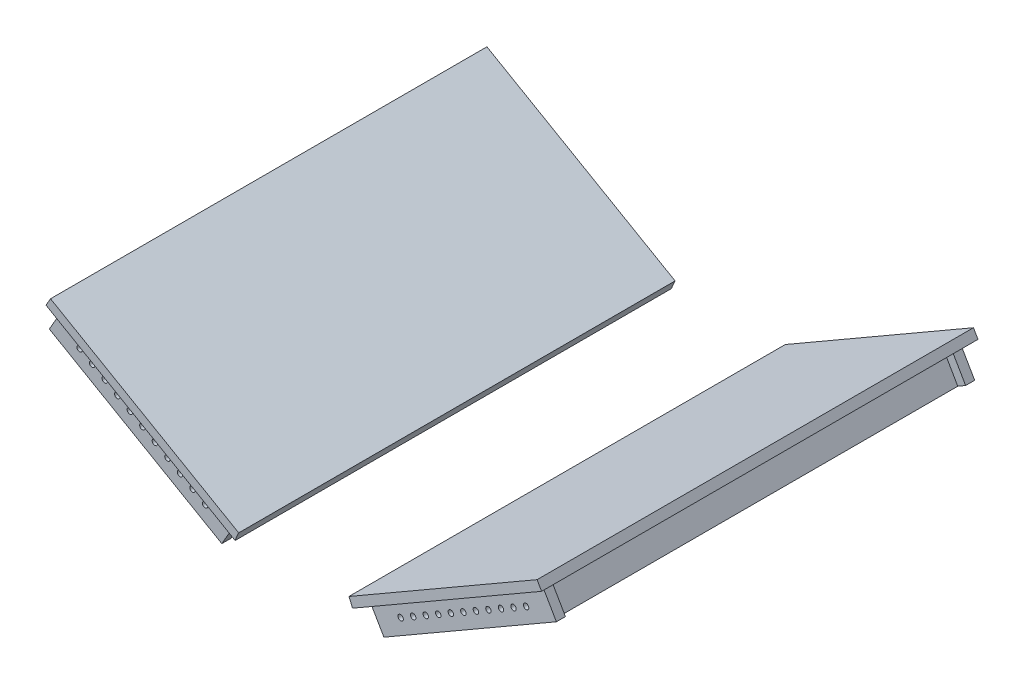
from build123d import *

# Parameters (mm, degrees)
BOSS_EXTRUDE1_DEPTH        = 273.05
BOSS_EXTRUDE1_DEPTH_BACK   = 339.09
BOSS_EXTRUDE1_2_DEPTH      = 273.05
BOSS_EXTRUDE1_2_DEPTH_BACK = 339.09
SKETCH2_W                  = 279.4
SKETCH2_H                  = 12.7
BOSS_EXTRUDE2_DEPTH        = 38.1
BOSS_EXTRUDE2_2_DEPTH      = 38.1
SKETCH3_W                  = 12.7
SKETCH3_H                  = 561.34
BOSS_EXTRUDE3_DEPTH        = 38.1
BOSS_EXTRUDE3_2_DEPTH      = 38.1
SKETCH5_W                  = 12.7
SKETCH5_H                  = 561.34
BOSS_EXTRUDE4_DEPTH        = 38.1
BOSS_EXTRUDE4_2_DEPTH      = 38.1
SKETCH6_R                  = 6.35
CUT_EXTRUDE1_DEPTH         = 12.7
SKETCH7_R                  = 6.35
CUT_EXTRUDE2_DEPTH         = 12.7
UNNECESSARY_DETAIL_DEPTH   = 612.14
CUT_EXTRUDE3_START         = -586.74
SKETCH9_R                  = 3.81
CUT_EXTRUDE3_DEPTH         = 586.74


with BuildPart() as part:
    # Sketch1 → Boss-Extrude1 (new, two sides: drawn at the far end of the back side and taken through both)
    with BuildSketch(Plane(origin=(392.915001613, 557.307056284, 808.85385267), x_dir=(1, 0, 0), z_dir=(0, 0, 1)).offset(-BOSS_EXTRUDE1_DEPTH_BACK)):
        Polygon((77.284288108, 39.663437012), (341.248831182, 192.063437012), (347.598831182, 181.064914384), (83.634288108, 28.664914384), align=None)
    extrude(amount=BOSS_EXTRUDE1_DEPTH + BOSS_EXTRUDE1_DEPTH_BACK)


with BuildPart() as body_2:
    # Sketch1 → Boss-Extrude1 2 (new, two sides: drawn at the far end of the back side and taken through both)
    with BuildSketch(Plane(origin=(392.915001613, 557.307056284, 808.85385267), x_dir=(1, 0, 0), z_dir=(0, 0, 1)).offset(-BOSS_EXTRUDE1_2_DEPTH_BACK)):
        Polygon((-77.284288108, 39.663437012), (-341.248831182, 192.063437012), (-347.598831182, 181.064914384), (-83.634288108, 28.664914384), align=None)
    extrude(amount=BOSS_EXTRUDE1_2_DEPTH + BOSS_EXTRUDE1_2_DEPTH_BACK)


with BuildPart() as body_3:
    # Sketch2 → Boss-Extrude2 (new body)
    with BuildSketch(Plane(origin=(331.053484628, 573.401455399, 0), x_dir=(0.8660254037844372, -0.5000000000000027, 0), z_dir=(-0.5000000000000027, -0.8660254037844372, 0))):
        with Locations((-177.541030539, 1062.85385267)):
            Rectangle(SKETCH2_W, SKETCH2_H)
    boss_extrude2 = extrude(amount=BOSS_EXTRUDE2_DEPTH)


with BuildPart() as body_4:
    # Sketch2 → Boss-Extrude2 2 (new body)
    with BuildSketch(Plane(origin=(331.053484628, 573.401455399, 0), x_dir=(0.8660254037844372, -0.5000000000000027, 0), z_dir=(-0.5000000000000027, -0.8660254037844372, 0))):
        with Locations((-177.541030539, 488.81385267)):
            Rectangle(SKETCH2_W, SKETCH2_H)
    boss_extrude2_2 = extrude(amount=BOSS_EXTRUDE2_2_DEPTH)


with BuildPart() as body_5:
    # Sketch3 → Boss-Extrude3 (new body)
    with BuildSketch(Plane(origin=(331.053484628, 573.401455399, 0), x_dir=(0.8660254037844372, -0.5000000000000027, 0), z_dir=(-0.5000000000000027, -0.8660254037844372, 0))):
        with Locations((-56.891030539, 775.83385267)):
            Rectangle(SKETCH3_W, SKETCH3_H)
    extrude(amount=BOSS_EXTRUDE3_DEPTH)

    # Sketch6 → Cut-Extrude1 (cut)
    with BuildSketch(Plane(origin=(-43.76981638, 25.270515269, 0), x_dir=(0, 0, -1), z_dir=(0.866025403784437, -0.5000000000000028, 0))):
        with Locations(Location((-775.671183514, 643.215670872, 0), (0, 0, 90))):
            Circle(SKETCH6_R)
        with Locations(Location((-621.90985267, 643.056969256, 0), (0, 0, 90))):
            Circle(SKETCH6_R)
        with Locations(Location((-929.75785267, 643.056969256, 0), (0, 0, 90))):
            Circle(SKETCH6_R)
    extrude(amount=-CUT_EXTRUDE1_DEPTH, mode=Mode.SUBTRACT)


with BuildPart() as body_6:
    # Sketch3 → Boss-Extrude3 2 (new body)
    with BuildSketch(Plane(origin=(331.053484628, 573.401455399, 0), x_dir=(0.8660254037844372, -0.5000000000000027, 0), z_dir=(-0.5000000000000027, -0.8660254037844372, 0))):
        with Locations((-298.191030539, 775.83385267)):
            Rectangle(SKETCH3_W, SKETCH3_H)
    extrude(amount=BOSS_EXTRUDE3_2_DEPTH)


with BuildPart() as part_1:
    add(part.part)

    # Mirror1: Boss-Extrude2, Boss-Extrude2 2 across plane
    add(boss_extrude2.mirror(Plane(origin=(392.915001613, 0, 0), x_dir=(0, 0, 1), z_dir=(1, 0, 0))))
    add(boss_extrude2_2.mirror(Plane(origin=(392.915001613, 0, 0), x_dir=(0, 0, 1), z_dir=(1, 0, 0))))

    add(body_2.part)  # Unnecessary Detail merges body 2
    # Sketch8 → Unnecessary Detail (add)
    with BuildSketch(Plane.XY.offset(1081.90385267)):
        with BuildLine():
            Line((310.642299926, 585.186295534), (303.796277895, 589.138411043))
            Line((303.796277895, 589.138411043), (309.256490029, 600.650652935))
            Line((309.256490029, 600.650652935), (315.630713504, 596.970493296))
            ThreePointArc((315.630713504, 596.970493296), (312.919219991, 591.170374885), (310.642299926, 585.186295534))
        make_face()
        with BuildLine():
            Line((475.187703299, 585.186295534), (485.552882068, 591.170197133))
            Line((485.552882068, 591.170197133), (477.229929452, 601.029635038))
            Line((477.229929452, 601.029635038), (470.199289721, 596.970493296))
            ThreePointArc((470.199289721, 596.970493296), (472.910783235, 591.170374885), (475.187703299, 585.186295534))
        make_face()
    extrude(amount=-UNNECESSARY_DETAIL_DEPTH)


with BuildPart() as body_7:
    # Sketch5 → Boss-Extrude4 (new body)
    with BuildSketch(Plane(origin=(-134.595983822, 233.127082474, 0), x_dir=(0.8660254037844386, 0.5000000000000002, 0), z_dir=(0.5000000000000001, -0.8660254037844385, 0))):
        with Locations((737.439776387, 775.83385267)):
            Rectangle(SKETCH5_W, SKETCH5_H)
    extrude(amount=BOSS_EXTRUDE4_DEPTH)

    # Sketch7 → Cut-Extrude2 (cut)
    with BuildSketch(Plane(origin=(633.142318799, 365.544888194, 0), x_dir=(0, 0, 1), z_dir=(-0.8660254037844385, -0.5000000000000003, 0))):
        with Locations(Location((775.83385267, 250.141967644, 0), (0, 0, 270))):
            Circle(SKETCH7_R)
        with Locations(Location((929.75785267, 250.141967644, 0), (0, 0, 270))):
            Circle(SKETCH7_R)
        with Locations(Location((621.90985267, 250.141967644, 0), (0, 0, 270))):
            Circle(SKETCH7_R)
    extrude(amount=-CUT_EXTRUDE2_DEPTH, mode=Mode.SUBTRACT)


with BuildPart() as body_8:
    # Sketch5 → Boss-Extrude4 2 (new body)
    with BuildSketch(Plane(origin=(-134.595983822, 233.127082474, 0), x_dir=(0.8660254037844386, 0.5000000000000002, 0), z_dir=(0.5000000000000001, -0.8660254037844385, 0))):
        with Locations((978.739776387, 775.83385267)):
            Rectangle(SKETCH5_W, SKETCH5_H)
    extrude(amount=BOSS_EXTRUDE4_2_DEPTH)


with BuildPart() as cut_extrude3_tool:
    # Sketch9 → Cut-Extrude3 (new body)
    with BuildSketch(Plane.XY.offset(1069.20385267).offset(CUT_EXTRUDE3_START)):
        with Locations((255.761622992, 594.874186726)):
            Circle(SKETCH9_R)
        with Locations((238.163986787, 605.034186726)):
            Circle(SKETCH9_R)
        with Locations((220.566350582, 615.194186726)):
            Circle(SKETCH9_R)
        with Locations((202.968714377, 625.354186726)):
            Circle(SKETCH9_R)
        with Locations((185.371078173, 635.514186726)):
            Circle(SKETCH9_R)
        with Locations((167.773441968, 645.674186726)):
            Circle(SKETCH9_R)
        with Locations((150.175805763, 655.834186726)):
            Circle(SKETCH9_R)
        with Locations((132.578169558, 665.994186726)):
            Circle(SKETCH9_R)
        with Locations((114.980533353, 676.154186726)):
            Circle(SKETCH9_R)
        with Locations((97.382897148, 686.314186726)):
            Circle(SKETCH9_R)
        with Locations((79.785260943, 696.474186726)):
            Circle(SKETCH9_R)
        with Locations((706.044742282, 696.474186726)):
            Circle(SKETCH9_R)
        with Locations((688.447106077, 686.314186726)):
            Circle(SKETCH9_R)
        with Locations((670.849469872, 676.154186726)):
            Circle(SKETCH9_R)
        with Locations((653.251833667, 665.994186726)):
            Circle(SKETCH9_R)
        with Locations((635.654197462, 655.834186726)):
            Circle(SKETCH9_R)
        with Locations((618.056561257, 645.674186726)):
            Circle(SKETCH9_R)
        with Locations((600.458925052, 635.514186726)):
            Circle(SKETCH9_R)
        with Locations((582.861288848, 625.354186726)):
            Circle(SKETCH9_R)
        with Locations((565.263652643, 615.194186726)):
            Circle(SKETCH9_R)
        with Locations((547.666016438, 605.034186726)):
            Circle(SKETCH9_R)
        with Locations((530.068380233, 594.874186726)):
            Circle(SKETCH9_R)
    cut_extrude3 = extrude(amount=CUT_EXTRUDE3_DEPTH)


with BuildPart() as part_2:
    add(part_1.part)

    # Cut-Extrude3: cut by cut_extrude3_tool
    add(cut_extrude3_tool.part, mode=Mode.SUBTRACT)


with BuildPart() as body_3_1:
    add(body_3.part)

    # Cut-Extrude3: cut by cut_extrude3_tool
    add(cut_extrude3_tool.part, mode=Mode.SUBTRACT)


with BuildPart() as body_4_1:
    add(body_4.part)

    # Mirror2: Cut-Extrude3 across plane
    add(cut_extrude3.mirror(Plane.XY.offset(775.83385267)), mode=Mode.SUBTRACT)


solid = Compound([body_5.part, body_6.part, body_7.part, body_8.part, part_2.part, body_3_1.part, body_4_1.part])
